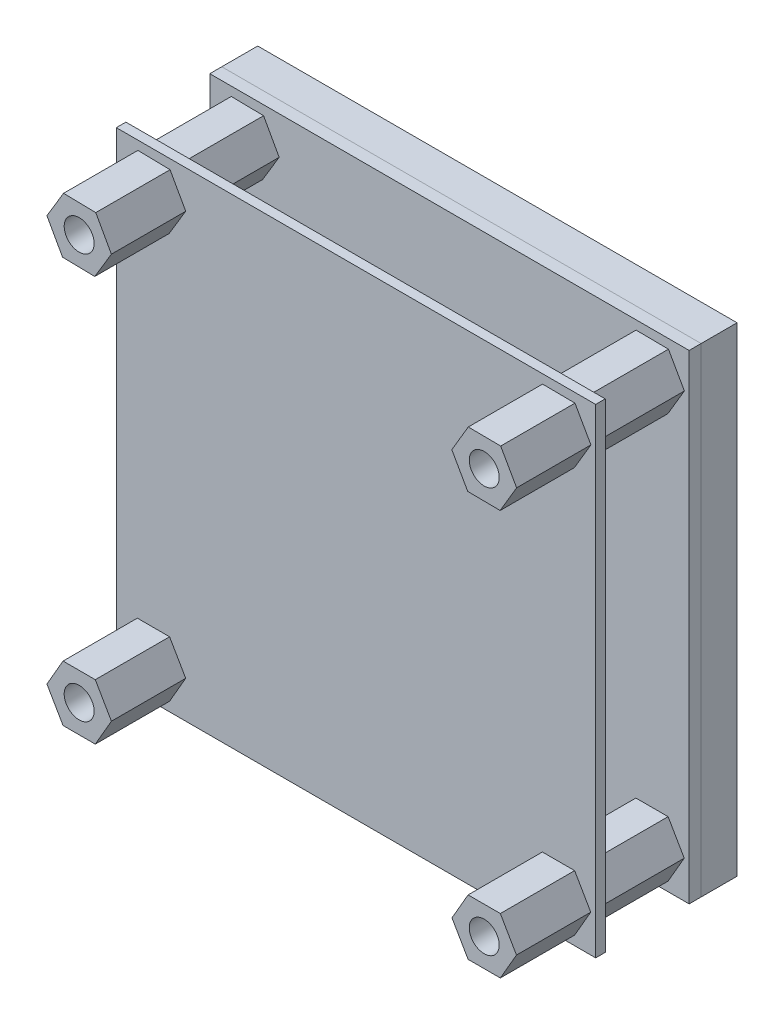
from build123d import *

# Parameters (mm, degrees)
SKETCH1_W             = 40
SKETCH1_H             = 40
BOSS_EXTRUDE1_DEPTH   = 3
SKETCH2_W             = 40
SKETCH2_H             = 40
BOSS_EXTRUDE2_DEPTH   = 1
SKETCH3_R             = 1.25
BOSS_EXTRUDE3_DEPTH   = 14
BOSS_EXTRUDE3_2_DEPTH = 14
BOSS_EXTRUDE3_3_DEPTH = 14
BOSS_EXTRUDE3_4_DEPTH = 14
SKETCH4_W             = 40
SKETCH4_H             = 40
BOSS_EXTRUDE4_DEPTH   = 0.8


with BuildPart() as part:
    # Sketch1 → Boss-Extrude1 (new body)
    with BuildSketch(Plane.XY):
        Rectangle(SKETCH1_W, SKETCH1_H)
    extrude(amount=BOSS_EXTRUDE1_DEPTH)


with BuildPart() as body_2:
    # Sketch2 → Boss-Extrude2 (new body)
    with BuildSketch(Plane.XY.offset(3)):
        Rectangle(SKETCH2_W, SKETCH2_H)
    extrude(amount=BOSS_EXTRUDE2_DEPTH)


with BuildPart() as body_3:
    # Sketch3 → Boss-Extrude3 (new body)
    with BuildSketch(Plane.XY.offset(4)):
        Polygon((-15.59757022, 14.545810118), (-14.209996867, 16.850842335), (-15.512426647, 19.205032217), (-18.20242978, 19.254189882), (-19.590003133, 16.949157665), (-18.287573353, 14.594967783), align=None)
        with Locations((-16.9, 16.9)):
            Circle(SKETCH3_R, mode=Mode.SUBTRACT)
    extrude(amount=BOSS_EXTRUDE3_DEPTH)



with BuildPart() as body_4:
    # Sketch3 → Boss-Extrude3 2 (new body)
    with BuildSketch(Plane.XY.offset(4)):
        Polygon((18.228941115, 14.545810118), (19.603258801, 16.873801825), (18.274317686, 19.227991707), (15.571058885, 19.254189882), (14.196741199, 16.926198175), (15.525682314, 14.572008293), align=None)
        with Locations((16.9, 16.9)):
            Circle(SKETCH3_R, mode=Mode.SUBTRACT)
    extrude(amount=BOSS_EXTRUDE3_2_DEPTH)


with BuildPart() as body_5:
    # Sketch3 → Boss-Extrude3 3 (new body)
    with BuildSketch(Plane.XY.offset(4)):
        Polygon((19.590452254, -16.9), (18.245226127, -14.57), (15.554773873, -14.57), (14.209547746, -16.9), (15.554773873, -19.23), (18.245226127, -19.23), align=None)
        with Locations((16.9, -16.9)):
            Circle(SKETCH3_R, mode=Mode.SUBTRACT)
    extrude(amount=BOSS_EXTRUDE3_3_DEPTH)


with BuildPart() as body_6:
    # Sketch3 → Boss-Extrude3 4 (new body)
    with BuildSketch(Plane.XY.offset(4)):
        Polygon((-14.209547746, -16.9), (-15.554773873, -14.57), (-18.245226127, -14.57), (-19.590452254, -16.9), (-18.245226127, -19.23), (-15.554773873, -19.23), align=None)
        with Locations((-16.9, -16.9)):
            Circle(SKETCH3_R, mode=Mode.SUBTRACT)
    extrude(amount=BOSS_EXTRUDE3_4_DEPTH)


with BuildPart() as body_3_1:
    add(body_3.part)

    add(body_4.part)  # Boss-Extrude4 merges body 4

    add(body_5.part)  # Boss-Extrude4 merges body 5

    add(body_6.part)  # Boss-Extrude4 merges body 6
    # Sketch4 → Boss-Extrude4 (add)
    with BuildSketch(Plane.XY.offset(11)):
        Rectangle(SKETCH4_W, SKETCH4_H)
    extrude(amount=BOSS_EXTRUDE4_DEPTH)


solid = Compound([part.part, body_2.part, body_3_1.part])
